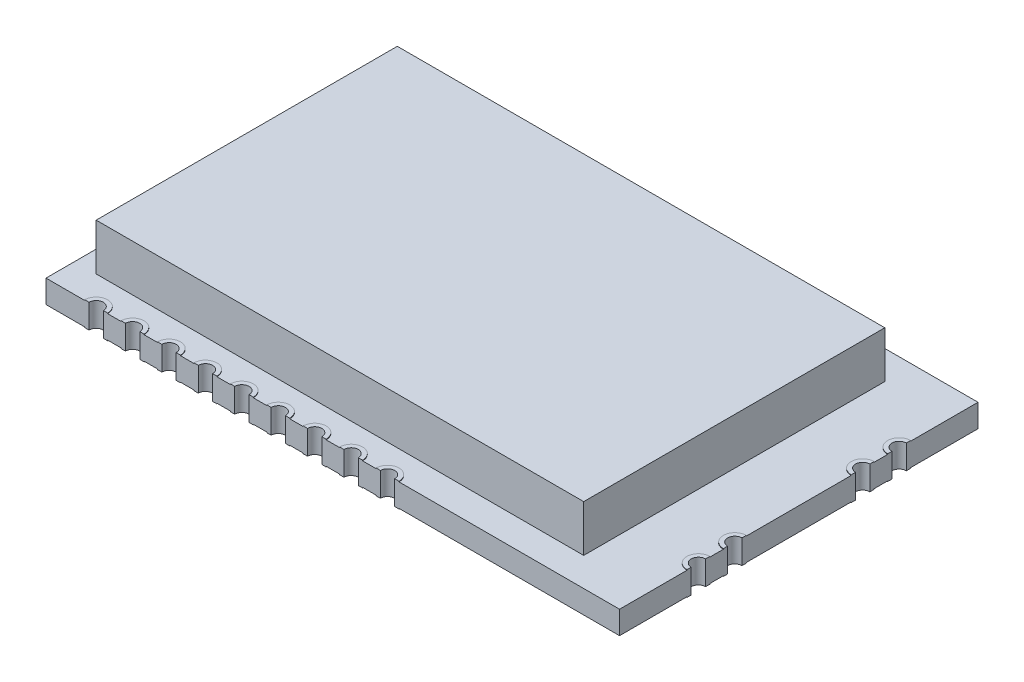
from build123d import *

# Parameters (mm, degrees)
BOSS_EXTRUDE1_DEPTH = 1.6
BOSS_EXTRUDE2_DEPTH = 0.04
BOSS_EXTRUDE3_START = 0.04
BOSS_EXTRUDE3_DEPTH = 0.04
SKETCH11_W          = 34
SKETCH11_H          = 21
BOSS_EXTRUDE5_DEPTH = 3.25


with BuildPart() as part:
    # Sketch1 → Boss-Extrude1 (new body)
    with BuildSketch(Plane(origin=(0, 0, 0), x_dir=(1, 0, 0), z_dir=(0, 1, 0))):
        with BuildLine():
            Line((20, 7.5), (20, 12.5))
            Line((20, 12.5), (4.32, 12.5))
            ThreePointArc((4.32, 12.5), (3.82, 12), (3.32, 12.5))
            Line((3.32, 12.5), (1.78, 12.5))
            ThreePointArc((1.78, 12.5), (1.28, 12), (0.78, 12.5))
            Line((0.78, 12.5), (-0.76, 12.5))
            ThreePointArc((-0.76, 12.5), (-1.26, 12), (-1.76, 12.5))
            Line((-1.76, 12.5), (-3.3, 12.5))
            ThreePointArc((-3.3, 12.5), (-3.8, 12), (-4.3, 12.5))
            Line((-4.3, 12.5), (-5.84, 12.5))
            ThreePointArc((-5.84, 12.5), (-6.34, 12), (-6.84, 12.5))
            Line((-6.84, 12.5), (-8.38, 12.5))
            ThreePointArc((-8.38, 12.5), (-8.88, 12), (-9.38, 12.5))
            Line((-9.38, 12.5), (-10.92, 12.5))
            ThreePointArc((-10.92, 12.5), (-11.42, 12), (-11.92, 12.5))
            Line((-11.92, 12.5), (-13.46, 12.5))
            ThreePointArc((-13.46, 12.5), (-13.96, 12), (-14.46, 12.5))
            Line((-14.46, 12.5), (-16, 12.5))
            ThreePointArc((-16, 12.5), (-16.5, 12), (-17, 12.5))
            Line((-17, 12.5), (-20, 12.5))
            Line((-20, 12.5), (-20, -12.5))
            Line((-20, -12.5), (-17, -12.5))
            ThreePointArc((-17, -12.5), (-16.5, -12), (-16, -12.5))
            Line((-16, -12.5), (-14.46, -12.5))
            ThreePointArc((-14.46, -12.5), (-13.96, -12), (-13.46, -12.5))
            Line((-13.46, -12.5), (-11.92, -12.5))
            ThreePointArc((-11.92, -12.5), (-11.42, -12), (-10.92, -12.5))
            Line((-10.92, -12.5), (-9.38, -12.5))
            ThreePointArc((-9.38, -12.5), (-8.88, -12), (-8.38, -12.5))
            Line((-8.38, -12.5), (-6.84, -12.5))
            ThreePointArc((-6.84, -12.5), (-6.34, -12), (-5.84, -12.5))
            Line((-5.84, -12.5), (-4.3, -12.5))
            ThreePointArc((-4.3, -12.5), (-3.8, -12), (-3.3, -12.5))
            Line((-3.3, -12.5), (-1.76, -12.5))
            ThreePointArc((-1.76, -12.5), (-1.26, -12), (-0.76, -12.5))
            Line((-0.76, -12.5), (0.78, -12.5))
            ThreePointArc((0.78, -12.5), (1.28, -12), (1.78, -12.5))
            Line((1.78, -12.5), (3.32, -12.5))
            ThreePointArc((3.32, -12.5), (3.82, -12), (4.32, -12.5))
            Line((4.32, -12.5), (20, -12.5))
            Line((20, -12.5), (20, -7.5))
            ThreePointArc((20, -7.5), (19.5, -7), (20, -6.5))
            Line((20, -6.5), (20, -4.96))
            ThreePointArc((20, -4.96), (19.5, -4.46), (20, -3.96))
            Line((20, -3.96), (20, 3.96))
            ThreePointArc((20, 3.96), (19.5, 4.46), (20, 4.96))
            Line((20, 4.96), (20, 6.5))
            ThreePointArc((20, 6.5), (19.5, 7), (20, 7.5))
        make_face()
    extrude(amount=BOSS_EXTRUDE1_DEPTH)

    # Sketch2 → Boss-Extrude2 (add)
    with BuildSketch(Plane(origin=(0, 1.6, 0), x_dir=(1, 0, 0), z_dir=(0, 1, 0))):
        with BuildLine():
            Line((-17, 12.5), (-17.3, 12.5))
            ThreePointArc((-17.3, 12.5), (-16.5, 11.7), (-15.7, 12.5))
            Line((-15.7, 12.5), (-16, 12.5))
            ThreePointArc((-16, 12.5), (-16.5, 12), (-17, 12.5))
        make_face()
        with BuildLine():
            Line((-14.76, 12.5), (-14.46, 12.5))
            ThreePointArc((-14.46, 12.5), (-13.96, 12), (-13.46, 12.5))
            Line((-13.46, 12.5), (-13.16, 12.5))
            ThreePointArc((-13.16, 12.5), (-13.96, 11.7), (-14.76, 12.5))
        make_face()
        with BuildLine():
            Line((4.32, 12.5), (4.62, 12.5))
            ThreePointArc((4.62, 12.5), (3.82, 11.7), (3.02, 12.5))
            Line((3.02, 12.5), (3.32, 12.5))
            ThreePointArc((3.32, 12.5), (3.82, 12), (4.32, 12.5))
        make_face()
        with BuildLine():
            Line((2.08, 12.5), (1.78, 12.5))
            ThreePointArc((1.78, 12.5), (1.28, 12), (0.78, 12.5))
            Line((0.78, 12.5), (0.48, 12.5))
            ThreePointArc((0.48, 12.5), (1.28, 11.7), (2.08, 12.5))
        make_face()
        with BuildLine():
            Line((-0.76, 12.5), (-0.46, 12.5))
            ThreePointArc((-0.46, 12.5), (-1.26, 11.7), (-2.06, 12.5))
            Line((-2.06, 12.5), (-1.76, 12.5))
            ThreePointArc((-1.76, 12.5), (-1.26, 12), (-0.76, 12.5))
        make_face()
        with BuildLine():
            Line((-4.6, 12.5), (-4.3, 12.5))
            ThreePointArc((-4.3, 12.5), (-3.8, 12), (-3.3, 12.5))
            Line((-3.3, 12.5), (-3, 12.5))
            ThreePointArc((-3, 12.5), (-3.8, 11.7), (-4.6, 12.5))
        make_face()
        with BuildLine():
            Line((-7.14, 12.5), (-6.84, 12.5))
            ThreePointArc((-6.84, 12.5), (-6.34, 12), (-5.84, 12.5))
            Line((-5.84, 12.5), (-5.54, 12.5))
            ThreePointArc((-5.54, 12.5), (-6.34, 11.7), (-7.14, 12.5))
        make_face()
        with BuildLine():
            Line((-8.38, 12.5), (-8.08, 12.5))
            ThreePointArc((-8.08, 12.5), (-8.88, 11.7), (-9.68, 12.5))
            Line((-9.68, 12.5), (-9.38, 12.5))
            ThreePointArc((-9.38, 12.5), (-8.88, 12), (-8.38, 12.5))
        make_face()
        with BuildLine():
            Line((-12.22, 12.5), (-11.92, 12.5))
            ThreePointArc((-11.92, 12.5), (-11.42, 12), (-10.92, 12.5))
            Line((-10.92, 12.5), (-10.62, 12.5))
            ThreePointArc((-10.62, 12.5), (-11.42, 11.7), (-12.22, 12.5))
        make_face()
        with BuildLine():
            Line((-17.3, -12.5), (-17, -12.5))
            ThreePointArc((-17, -12.5), (-16.5, -12), (-16, -12.5))
            Line((-16, -12.5), (-15.7, -12.5))
            ThreePointArc((-15.7, -12.5), (-16.5, -11.7), (-17.3, -12.5))
        make_face()
        with BuildLine():
            Line((4.32, -12.5), (4.62, -12.5))
            ThreePointArc((4.62, -12.5), (3.82, -11.7), (3.02, -12.5))
            Line((3.02, -12.5), (3.32, -12.5))
            ThreePointArc((3.32, -12.5), (3.82, -12), (4.32, -12.5))
        make_face()
        with BuildLine():
            Line((1.78, -12.5), (2.08, -12.5))
            ThreePointArc((2.08, -12.5), (1.28, -11.7), (0.48, -12.5))
            Line((0.48, -12.5), (0.78, -12.5))
            ThreePointArc((0.78, -12.5), (1.28, -12), (1.78, -12.5))
        make_face()
        with BuildLine():
            Line((-2.06, -12.5), (-1.76, -12.5))
            ThreePointArc((-1.76, -12.5), (-1.26, -12), (-0.76, -12.5))
            Line((-0.76, -12.5), (-0.46, -12.5))
            ThreePointArc((-0.46, -12.5), (-1.26, -11.7), (-2.06, -12.5))
        make_face()
        with BuildLine():
            Line((-4.6, -12.5), (-4.3, -12.5))
            ThreePointArc((-4.3, -12.5), (-3.8, -12), (-3.3, -12.5))
            Line((-3.3, -12.5), (-3, -12.5))
            ThreePointArc((-3, -12.5), (-3.8, -11.7), (-4.6, -12.5))
        make_face()
        with BuildLine():
            Line((-7.14, -12.5), (-6.84, -12.5))
            ThreePointArc((-6.84, -12.5), (-6.34, -12), (-5.84, -12.5))
            Line((-5.84, -12.5), (-5.54, -12.5))
            ThreePointArc((-5.54, -12.5), (-6.34, -11.7), (-7.14, -12.5))
        make_face()
        with BuildLine():
            Line((-9.68, -12.5), (-9.38, -12.5))
            ThreePointArc((-9.38, -12.5), (-8.88, -12), (-8.38, -12.5))
            Line((-8.38, -12.5), (-8.08, -12.5))
            ThreePointArc((-8.08, -12.5), (-8.88, -11.7), (-9.68, -12.5))
        make_face()
        with BuildLine():
            Line((-12.22, -12.5), (-11.92, -12.5))
            ThreePointArc((-11.92, -12.5), (-11.42, -12), (-10.92, -12.5))
            Line((-10.92, -12.5), (-10.62, -12.5))
            ThreePointArc((-10.62, -12.5), (-11.42, -11.7), (-12.22, -12.5))
        make_face()
        with BuildLine():
            Line((-14.76, -12.5), (-14.46, -12.5))
            ThreePointArc((-14.46, -12.5), (-13.96, -12), (-13.46, -12.5))
            Line((-13.46, -12.5), (-13.16, -12.5))
            ThreePointArc((-13.16, -12.5), (-13.96, -11.7), (-14.76, -12.5))
        make_face()
        with BuildLine():
            Line((20, -6.2), (20, -6.5))
            ThreePointArc((20, -6.5), (19.5, -7), (20, -7.5))
            Line((20, -7.5), (20, -7.8))
            ThreePointArc((20, -7.8), (19.2, -7), (20, -6.2))
        make_face()
        with BuildLine():
            Line((20, 7.8), (20, 7.5))
            ThreePointArc((20, 7.5), (19.5, 7), (20, 6.5))
            Line((20, 6.5), (20, 6.2))
            ThreePointArc((20, 6.2), (19.2, 7), (20, 7.8))
        make_face()
        with BuildLine():
            Line((20, 5.26), (20, 4.96))
            ThreePointArc((20, 4.96), (19.5, 4.46), (20, 3.96))
            Line((20, 3.96), (20, 3.66))
            ThreePointArc((20, 3.66), (19.2, 4.46), (20, 5.26))
        make_face()
        with BuildLine():
            Line((20, -3.66), (20, -3.96))
            ThreePointArc((20, -3.96), (19.5, -4.46), (20, -4.96))
            Line((20, -4.96), (20, -5.26))
            ThreePointArc((20, -5.26), (19.2, -4.46), (20, -3.66))
        make_face()
    extrude(amount=BOSS_EXTRUDE2_DEPTH)

    # Sketch9 → Boss-Extrude3 (add)
    with BuildSketch(Plane(origin=(0, 0, 0), x_dir=(-1, 0, 0), z_dir=(0, -1, 0)).offset(BOSS_EXTRUDE3_START)):
        with BuildLine():
            Line((17, 12.5), (17.299014687, 12.5))
            Line((17.299014687, 12.5), (17.299014687, 10.504982051))
            Line((17.299014687, 10.504982051), (15.694412599, 10.504982051))
            Line((15.694412599, 10.504982051), (15.694412599, 12.5))
            Line((15.694412599, 12.5), (16, 12.5))
            ThreePointArc((16, 12.5), (16.5, 12), (17, 12.5))
        make_face()
        with BuildLine():
            Line((14.46, 12.5), (14.76, 12.5))
            Line((14.76, 12.5), (14.76, 10.504982051))
            Line((14.76, 10.504982051), (13.16, 10.504982051))
            Line((13.16, 10.504982051), (13.16, 12.5))
            Line((13.16, 12.5), (13.46, 12.5))
            ThreePointArc((13.46, 12.5), (13.96, 12), (14.46, 12.5))
        make_face()
        with BuildLine():
            Line((11.92, 12.5), (12.22, 12.5))
            Line((12.22, 12.5), (12.22, 10.504982051))
            Line((12.22, 10.504982051), (10.62, 10.504982051))
            Line((10.62, 10.504982051), (10.62, 12.5))
            Line((10.62, 12.5), (10.92, 12.5))
            ThreePointArc((10.92, 12.5), (11.42, 12), (11.92, 12.5))
        make_face()
        with BuildLine():
            Line((9.38, 12.5), (9.68, 12.5))
            Line((9.68, 12.5), (9.68, 10.504982051))
            Line((9.68, 10.504982051), (8.08, 10.504982051))
            Line((8.08, 10.504982051), (8.08, 12.5))
            Line((8.08, 12.5), (8.38, 12.5))
            ThreePointArc((8.38, 12.5), (8.88, 12), (9.38, 12.5))
        make_face()
        with BuildLine():
            Line((6.84, 12.5), (7.14, 12.5))
            Line((7.14, 12.5), (7.14, 10.504982051))
            Line((7.14, 10.504982051), (5.54, 10.504982051))
            Line((5.54, 10.504982051), (5.54, 12.5))
            Line((5.54, 12.5), (5.84, 12.5))
            ThreePointArc((5.84, 12.5), (6.34, 12), (6.84, 12.5))
        make_face()
        with BuildLine():
            Line((4.3, 12.5), (4.6, 12.5))
            Line((4.6, 12.5), (4.6, 10.504982051))
            Line((4.6, 10.504982051), (3, 10.504982051))
            Line((3, 10.504982051), (3, 12.5))
            Line((3, 12.5), (3.3, 12.5))
            ThreePointArc((3.3, 12.5), (3.8, 12), (4.3, 12.5))
        make_face()
        with BuildLine():
            Line((1.76, 12.5), (2.06, 12.5))
            Line((2.06, 12.5), (2.06, 10.504982051))
            Line((2.06, 10.504982051), (0.46, 10.504982051))
            Line((0.46, 10.504982051), (0.46, 12.5))
            Line((0.46, 12.5), (0.76, 12.5))
            ThreePointArc((0.76, 12.5), (1.26, 12), (1.76, 12.5))
        make_face()
        with BuildLine():
            Line((-0.78, 12.5), (-0.48, 12.5))
            Line((-0.48, 12.5), (-0.48, 10.504982051))
            Line((-0.48, 10.504982051), (-2.08, 10.504982051))
            Line((-2.08, 10.504982051), (-2.08, 12.5))
            Line((-2.08, 12.5), (-1.78, 12.5))
            ThreePointArc((-1.78, 12.5), (-1.28, 12), (-0.78, 12.5))
        make_face()
        with BuildLine():
            Line((-3.32, 12.5), (-3.02, 12.5))
            Line((-3.02, 12.5), (-3.02, 10.504982051))
            Line((-3.02, 10.504982051), (-4.62, 10.504982051))
            Line((-4.62, 10.504982051), (-4.62, 12.5))
            Line((-4.62, 12.5), (-4.32, 12.5))
            ThreePointArc((-4.32, 12.5), (-3.82, 12), (-3.32, 12.5))
        make_face()
        with BuildLine():
            Line((17, -12.5), (17.3, -12.5))
            Line((17.3, -12.5), (17.3, -10.5))
            Line((17.3, -10.5), (15.7, -10.5))
            Line((15.7, -10.5), (15.7, -12.5))
            Line((15.7, -12.5), (16, -12.5))
            ThreePointArc((16, -12.5), (16.5, -12), (17, -12.5))
        make_face()
        with BuildLine():
            Line((14.46, -12.5), (14.76, -12.5))
            Line((14.76, -12.5), (14.76, -10.5))
            Line((14.76, -10.5), (13.16, -10.5))
            Line((13.16, -10.5), (13.16, -12.5))
            Line((13.16, -12.5), (13.46, -12.5))
            ThreePointArc((13.46, -12.5), (13.96, -12), (14.46, -12.5))
        make_face()
        with BuildLine():
            Line((11.92, -12.5), (12.22, -12.5))
            Line((12.22, -12.5), (12.22, -10.5))
            Line((12.22, -10.5), (10.62, -10.5))
            Line((10.62, -10.5), (10.62, -12.5))
            Line((10.62, -12.5), (10.92, -12.5))
            ThreePointArc((10.92, -12.5), (11.42, -12), (11.92, -12.5))
        make_face()
        with BuildLine():
            Line((9.38, -12.5), (9.68, -12.5))
            Line((9.68, -12.5), (9.68, -10.5))
            Line((9.68, -10.5), (8.081935212, -10.5))
            Line((8.081935212, -10.5), (8.08, -12.5))
            Line((8.08, -12.5), (8.38, -12.5))
            ThreePointArc((8.38, -12.5), (8.88, -12), (9.38, -12.5))
        make_face()
        with BuildLine():
            Line((6.84, -12.5), (7.14, -12.5))
            Line((7.14, -12.5), (7.14, -10.5))
            Line((7.14, -10.5), (5.54, -10.5))
            Line((5.54, -10.5), (5.54, -12.5))
            Line((5.54, -12.5), (5.84, -12.5))
            ThreePointArc((5.84, -12.5), (6.34, -12), (6.84, -12.5))
        make_face()
        with BuildLine():
            Line((4.3, -12.5), (4.6, -12.5))
            Line((4.6, -12.5), (4.6, -10.5))
            Line((4.6, -10.5), (3.00817963, -10.5))
            Line((3.00817963, -10.5), (3.00817963, -12.5))
            Line((3.00817963, -12.5), (3.3, -12.5))
            ThreePointArc((3.3, -12.5), (3.8, -12), (4.3, -12.5))
        make_face()
        with BuildLine():
            Line((1.76, -12.5), (2.06, -12.5))
            Line((2.06, -12.5), (2.06, -10.5))
            Line((2.06, -10.5), (0.46, -10.5))
            Line((0.46, -10.5), (0.46, -12.5))
            Line((0.46, -12.5), (0.76, -12.5))
            ThreePointArc((0.76, -12.5), (1.26, -12), (1.76, -12.5))
        make_face()
        with BuildLine():
            Line((-0.78, -12.5), (-0.48, -12.5))
            Line((-0.48, -12.5), (-0.48, -10.5))
            Line((-0.48, -10.5), (-2.08, -10.5))
            Line((-2.08, -10.5), (-2.08, -12.5))
            Line((-2.08, -12.5), (-1.78, -12.5))
            ThreePointArc((-1.78, -12.5), (-1.28, -12), (-0.78, -12.5))
        make_face()
        with BuildLine():
            Line((-3.32, -12.5), (-3.02, -12.5))
            Line((-3.02, -12.5), (-3.02, -10.5))
            Line((-3.02, -10.5), (-4.62, -10.5))
            Line((-4.62, -10.5), (-4.62, -12.5))
            Line((-4.62, -12.5), (-4.32, -12.5))
            ThreePointArc((-4.32, -12.5), (-3.82, -12), (-3.32, -12.5))
        make_face()
        with BuildLine():
            Line((-20, 7.5), (-20, 7.8))
            Line((-20, 7.8), (-18, 7.8))
            Line((-18, 7.8), (-18, 6.2))
            Line((-18, 6.2), (-20, 6.2))
            Line((-20, 6.2), (-20, 6.5))
            ThreePointArc((-20, 6.5), (-19.5, 7), (-20, 7.5))
        make_face()
        with BuildLine():
            Line((-20, 4.96), (-20, 5.26))
            Line((-20, 5.26), (-18, 5.26))
            Line((-18, 5.26), (-18, 3.66))
            Line((-18, 3.66), (-20, 3.66))
            Line((-20, 3.66), (-20, 3.96))
            ThreePointArc((-20, 3.96), (-19.5, 4.46), (-20, 4.96))
        make_face()
        with BuildLine():
            Line((-20, -3.96), (-20, -3.66))
            Line((-20, -3.66), (-18, -3.66))
            Line((-18, -3.66), (-18, -5.26))
            Line((-18, -5.26), (-20, -5.26))
            Line((-20, -5.26), (-20, -4.96))
            ThreePointArc((-20, -4.96), (-19.5, -4.46), (-20, -3.96))
        make_face()
        with BuildLine():
            Line((-20, -6.5), (-20, -6.2))
            Line((-20, -6.2), (-18, -6.2))
            Line((-18, -6.2), (-18, -7.8))
            Line((-18, -7.8), (-20, -7.8))
            Line((-20, -7.8), (-20, -7.5))
            ThreePointArc((-20, -7.5), (-19.5, -7), (-20, -6.5))
        make_face()
    extrude(amount=-BOSS_EXTRUDE3_DEPTH)

    # Sketch11 → Boss-Extrude5 (add)
    with BuildSketch(Plane(origin=(0, 1.6, 0), x_dir=(1, 0, 0), z_dir=(0, 1, 0))):
        with Locations((-1.5, 0)):
            Rectangle(SKETCH11_W, SKETCH11_H)
    extrude(amount=BOSS_EXTRUDE5_DEPTH)


solid = part.part
